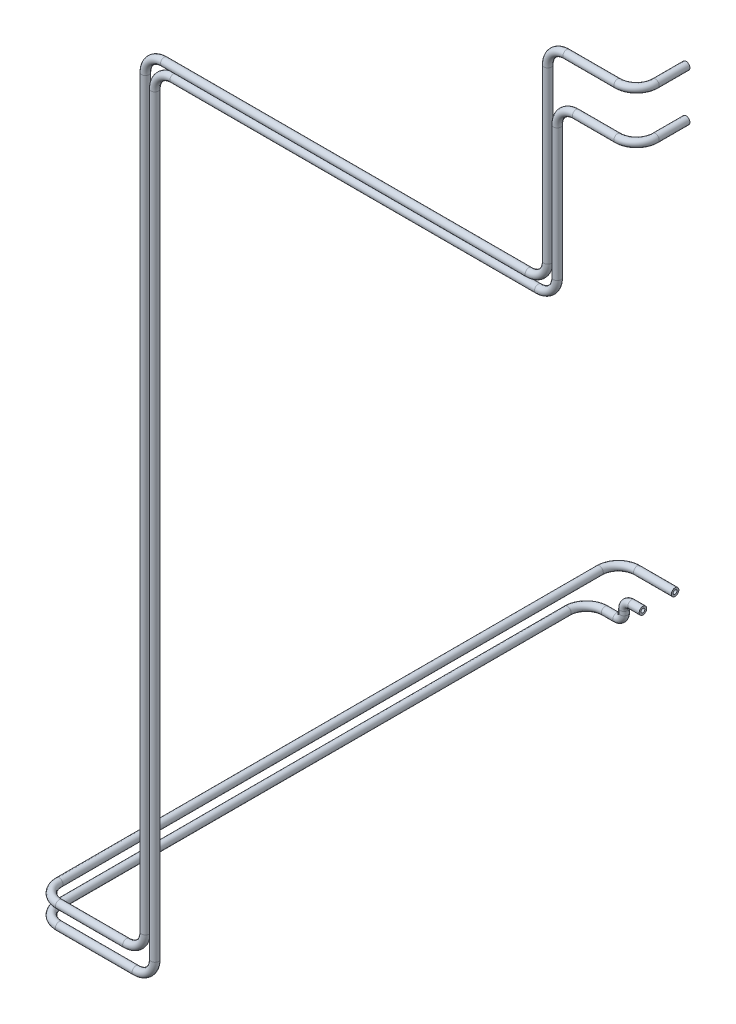
from build123d import *

# Parameters (mm, degrees)
SKETCH7_R    = 2
SKETCH7_R_2  = 1
SKETCH11_R   = 2
SKETCH11_R_2 = 1


with BuildPart() as part:
    # Sweep2: sweep along a curve in space
    with BuildLine() as sweep2_path:
        Line((0, 0, -26.25), (0, 0, -10))
        ThreePointArc((0, 0, -10), (-2.928932188, 0, -2.928932188), (-10, 0, 0))
        Line((-10, 0, 0), (-37, 0, 0))
        ThreePointArc((-37, 0, 0), (-44.071067812, -2.928932188, 0), (-47, -10, 0))
        Line((-47, -10, 0), (-47, -100, 0))
        ThreePointArc((-47, -100, 0), (-49.928932188, -107.071067812, 0), (-57, -110, 0))
        Line((-57, -110, 0), (-250, -110, 0))
        ThreePointArc((-250, -110, 0), (-257.071067812, -112.928932188, 0), (-260, -120, 0))
        Line((-260, -120, 0), (-260, -514, 0))
        ThreePointArc((-260, -514, 0), (-262.928932188, -521.071067812, 0), (-270, -524, 0))
        Line((-270, -524, 0), (-305.6, -524, 0))
        ThreePointArc((-305.6, -524, 0), (-312.671067812, -524, -2.928932188), (-315.6, -524, -10))
        Line((-315.6, -524, -10), (-315.6, -524, -296))
        ThreePointArc((-315.6, -524, -296), (-312.671067812, -524, -303.071067812), (-305.6, -524, -306))
        Line((-305.6, -524, -306), (-285.6, -524, -306))
    # Sketch7 → Sweep2 (sweep)
    with BuildSketch(Plane.XY.offset(-26.25)):
        Circle(SKETCH7_R)
        Circle(SKETCH7_R_2, mode=Mode.SUBTRACT)
    sweep(path=sweep2_path.line)


with BuildPart() as body_2:
    # Sweep3: sweep along a curve in space
    with BuildLine() as sweep3_path:
        Line((0, -25, -26.25), (0, -25, -10))
        ThreePointArc((0, -25, -10), (-2.928932188, -25, -2.928932188), (-10, -25, 0))
        Line((-10, -25, 0), (-32, -25, 0))
        ThreePointArc((-32, -25, 0), (-39.071067812, -27.928932188, 0), (-42, -35, 0))
        Line((-42, -35, 0), (-42, -105, 0))
        ThreePointArc((-42, -105, 0), (-44.928932188, -112.071067812, 0), (-52, -115, 0))
        Line((-52, -115, 0), (-245, -115, 0))
        ThreePointArc((-245, -115, 0), (-252.071067812, -117.928932188, 0), (-255, -125, 0))
        Line((-255, -125, 0), (-255, -524, 0))
        ThreePointArc((-255, -524, 0), (-257.928932188, -531.071067812, 0), (-265, -534, 0))
        Line((-265, -534, 0), (-305.6, -534, 0))
        ThreePointArc((-305.6, -534, 0), (-312.671067812, -534, -2.928932188), (-315.6, -534, -10))
        Line((-315.6, -534, -10), (-315.6, -534, -279))
        ThreePointArc((-315.6, -534, -279), (-312.671067812, -534, -286.071067812), (-305.6, -534, -289))
        Line((-305.6, -534, -289), (-299.6, -534, -289))
        ThreePointArc((-299.6, -534, -289), (-296.771572875, -532.828427125, -289), (-295.6, -530, -289))
        Line((-295.6, -530, -289), (-295.6, -528, -289))
        ThreePointArc((-295.6, -528, -289), (-294.428427125, -525.171572875, -289), (-291.6, -524, -289))
        Line((-291.6, -524, -289), (-285.6, -524, -289))
    # Sketch11 → Sweep3 (sweep)
    with BuildSketch(Plane.XY.offset(-26.25)):
        with Locations((0, -25)):
            Circle(SKETCH11_R)
        with Locations((0, -25)):
            Circle(SKETCH11_R_2, mode=Mode.SUBTRACT)
    sweep(path=sweep3_path.line)


solid = Compound([part.part, body_2.part])
